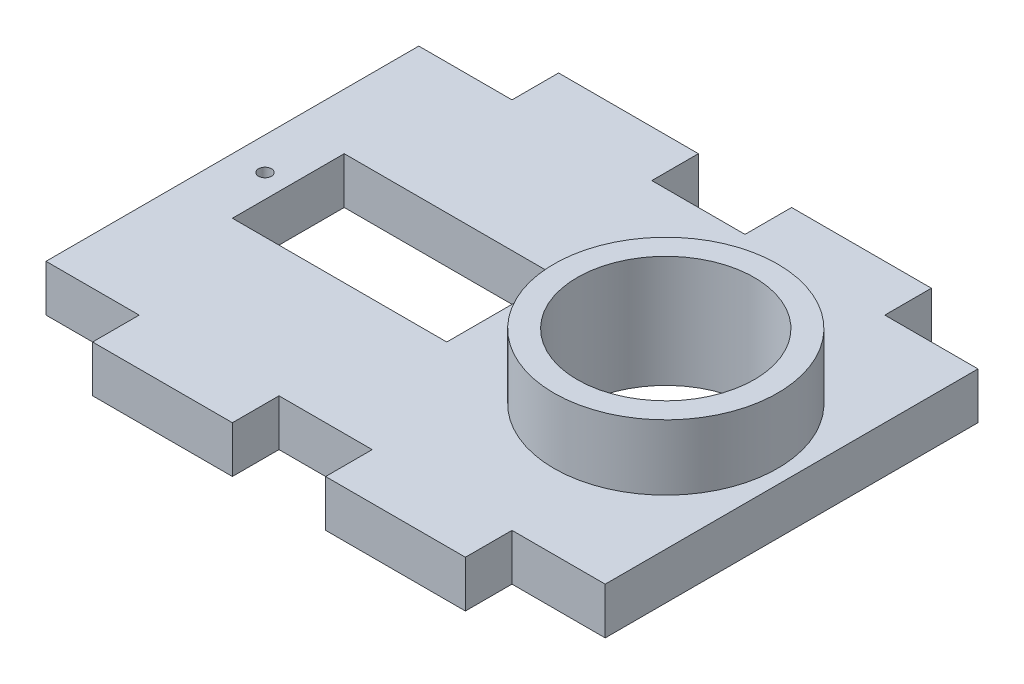
from build123d import *

# Parameters (mm, degrees)
SKETCH1_R           = 0.7
SKETCH1_R_2         = 9.5
SKETCH1_W           = 23
SKETCH1_H           = 12
BOSS_EXTRUDE1_DEPTH = 5
SKETCH2_R           = 12
SKETCH2_R_2         = 9.5
BOSS_EXTRUDE2_DEPTH = 7


with BuildPart() as part:
    # Sketch1 → Boss-Extrude1 (new body)
    with BuildSketch(Plane(origin=(0, 0, 0), x_dir=(1, 0, 0), z_dir=(0, 1, 0))):
        Polygon((7.5, 20), (17.5, 20), (17.5, 25), (32.5, 25), (32.5, 20), (42.5, 20), (42.5, -20), (32.5, -20), (32.5, -25), (17.5, -25), (17.5, -20), (7.5, -20), (7.5, -25), (-7.5, -25), (-7.5, -20), (-17.5, -20), (-17.5, 20), (-7.5, 20), (-7.5, 25), (7.5, 25), align=None)
        with Locations(Location((-14, 0, 0), (0, 0, 270))):
            Circle(SKETCH1_R, mode=Mode.SUBTRACT)
        with Locations(Location((14, 0, 0), (0, 0, 270))):
            Circle(SKETCH1_R, mode=Mode.SUBTRACT)
        with Locations(Location((29, 0, 0), (0, 0, 270))):
            Circle(SKETCH1_R_2, mode=Mode.SUBTRACT)
        Rectangle(SKETCH1_W, SKETCH1_H, mode=Mode.SUBTRACT)
    extrude(amount=BOSS_EXTRUDE1_DEPTH)

    # Sketch2 → Boss-Extrude2 (add)
    with BuildSketch(Plane(origin=(0, 5, 0), x_dir=(1, 0, 0), z_dir=(0, 1, 0))):
        with Locations(Location((29, 0, 0), (0, 0, 90))):
            Circle(SKETCH2_R)
        with Locations(Location((29, 0, 0), (0, 0, 270))):
            Circle(SKETCH2_R_2, mode=Mode.SUBTRACT)
    extrude(amount=BOSS_EXTRUDE2_DEPTH)


solid = part.part
